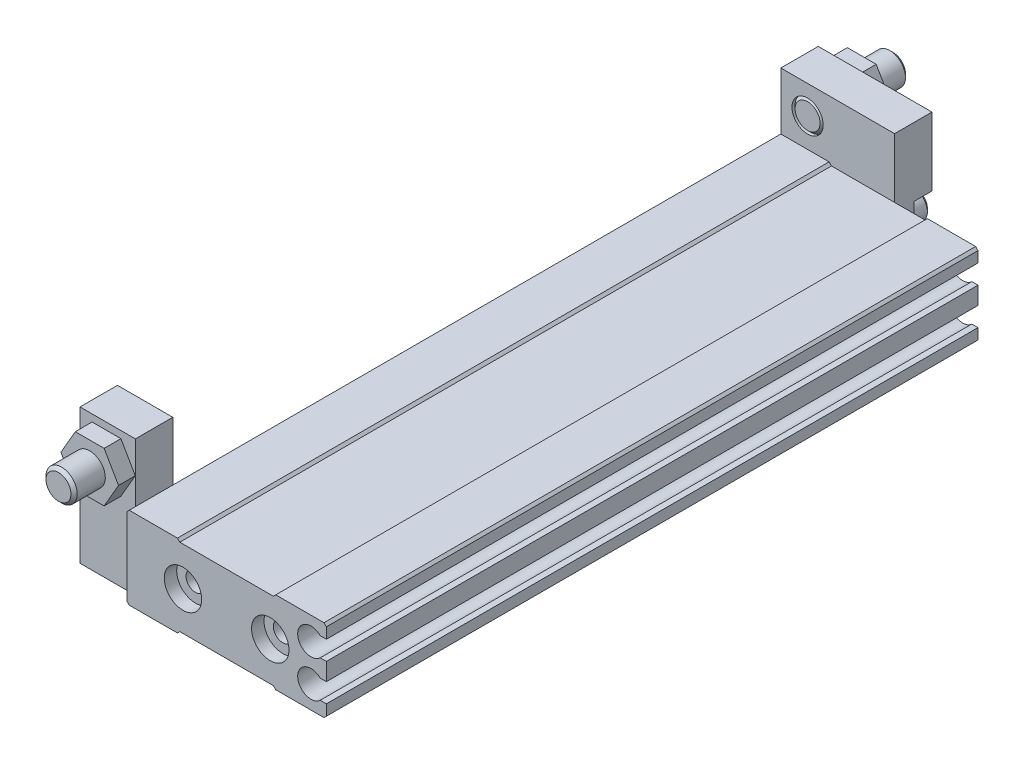
from build123d import *

# Parameters (mm, degrees)
BASE_EXTRUDE_START               = -104.5
BASE_EXTRUDE_DEPTH               = 104.5
SKETCH2_R                        = 3
CUT_EXTRUDE1_DEPTH               = 103.2
SKETCH4_R                        = 3
BOSS_EXTRUDE1_DEPTH              = 10
CUT_EXTRUDE3_REACH               = 105.95
SKETCH19_R                       = 1.5
F_4_40_TAPPED_HOLE2_D            = 2.2606
F_4_40_TAPPED_HOLE2_DEPTH        = 8.8646
F_4_40_TAPPED_HOLE2_CBORE_D      = 2.8448
F_4_40_TAPPED_HOLE2_CBORE_DEPTH  = 5.6896
F_4_40_TAPPED_HOLE2_TIP          = 0.679152758
F_3_48_TAPPED_HOLE1_D            = 2.0828
F_3_48_TAPPED_HOLE1_DEPTH        = 7.3025
F_3_48_TAPPED_HOLE1_CBORE_D      = 2.5146
F_3_48_TAPPED_HOLE1_CBORE_DEPTH  = 5.0292
F_3_48_TAPPED_HOLE1_TIP          = 0.625736249
HOLE1_D                          = 3.1877
HOLE1_DEPTH                      = 2.54
CUT_EXTRUDE4_DEPTH               = 2.5
F_10_32_TAPPED_HOLE1_D           = 4.0386
F_10_32_TAPPED_HOLE1_DEPTH       = 13.6144
F_10_32_TAPPED_HOLE1_CBORE_D     = 4.826
F_10_32_TAPPED_HOLE1_CBORE_DEPTH = 9.652
F_10_32_TAPPED_HOLE1_TIP         = 1.213317848
SKETCH30_W                       = 18.237
SKETCH30_H                       = 21.59
BOSS_EXTRUDE2_DEPTH              = 6
CUT_EXTRUDE9_DEPTH               = 2.87
BOSS_EXTRUDE3_DEPTH              = 2.6924
SKETCH35_R                       = 2.25
BOSS_EXTRUDE5_DEPTH              = 3
CHAMFER2_SIZE                    = 0.5
BOSS_EXTRUDE6_DEPTH              = 6
BOSS_EXTRUDE7_DEPTH              = 2.69
CUT_EXTRUDE7_REACH               = 120.219
SKETCH38_R                       = 2.5
CUT_EXTRUDE8_REACH               = 125.073
SKETCH46_R                       = 2.5
CHAMFER3_SIZE                    = 0.5


with BuildPart() as part:
    # Sketch1 → Base-Extrude (new body)
    with BuildSketch(Plane(origin=(0, 0, 57.15), x_dir=(-1, 0, 0), z_dir=(0, 0, 1)).offset(BASE_EXTRUDE_START)):
        with BuildLine():
            Line((15.619, 6.5913), (16, 6.2103))
            Line((16, 6.2103), (16, -6.2103))
            Line((16, -6.2103), (15.619, -6.5913))
            Line((15.619, -6.5913), (7.881, -6.5913))
            Line((7.881, -6.5913), (7.5, -6.2103))
            Line((7.5, -6.2103), (-7.5, -6.2103))
            Line((-7.5, -6.2103), (-7.881, -6.5913))
            Line((-7.881, -6.5913), (-15.619, -6.5913))
            Line((-15.619, -6.5913), (-16, -6.2103))
            Line((-16, -6.2103), (-16, -4.4831))
            Line((-16, -4.4831), (-15.013735828, -4.4831))
            ThreePointArc((-15.013735828, -4.4831), (-11.4, -2.9464), (-15.013735828, -1.4097))
            Line((-15.013735828, -1.4097), (-16, -1.4097))
            Line((-16, -1.4097), (-16, 1.4097))
            Line((-16, 1.4097), (-15.013735828, 1.4097))
            ThreePointArc((-15.013735828, 1.4097), (-11.4, 2.9464), (-15.013735828, 4.4831))
            Line((-15.013735828, 4.4831), (-16, 4.4831))
            Line((-16, 4.4831), (-16, 6.2103))
            Line((-16, 6.2103), (-15.619, 6.5913))
            Line((-15.619, 6.5913), (-7.881, 6.5913))
            Line((-7.881, 6.5913), (-7.5, 6.2103))
            Line((-7.5, 6.2103), (7.5, 6.2103))
            Line((7.5, 6.2103), (7.881, 6.5913))
            Line((7.881, 6.5913), (15.619, 6.5913))
        make_face()
    extrude(amount=BASE_EXTRUDE_DEPTH)

    # Sketch2 → Cut-Extrude1 (cut)
    with BuildSketch(Plane(origin=(0, 0, 57.15), x_dir=(-1, 0, 0), z_dir=(0, 0, -1))):
        with Locations(Location((-7, 0, 0), (0, 0, 180))):
            Circle(SKETCH2_R)
        with Locations(Location((7, 0, 0), (0, 0, 180))):
            Circle(SKETCH2_R)
    extrude(amount=CUT_EXTRUDE1_DEPTH, mode=Mode.SUBTRACT)

    # Sketch4 → Boss-Extrude1 (add)
    with BuildSketch(Plane.XY.offset(55.15)):
        with Locations((7, 0)):
            Circle(SKETCH4_R)
        with Locations((-7, 0)):
            Circle(SKETCH4_R)
    extrude(amount=-BOSS_EXTRUDE1_DEPTH)

    # Sketch19 → Cut-Extrude3 (cut, up to next)
    with BuildSketch(Plane.XY.offset(55.15), mode=Mode.PRIVATE) as cut_extrude3_sk1:
        with Locations((7, 0)):
            Circle(SKETCH19_R)
    cut_extrude3_tool1 = extrude(cut_extrude3_sk1.sketch, amount=-CUT_EXTRUDE3_REACH, mode=Mode.PRIVATE) & part.part
    # Sketch19 → Cut-Extrude3 (cut, up to next)
    with BuildSketch(Plane.XY.offset(55.15), mode=Mode.PRIVATE) as cut_extrude3_sk2:
        with Locations((-7, 0)):
            Circle(SKETCH19_R)
    cut_extrude3_tool2 = extrude(cut_extrude3_sk2.sketch, amount=-CUT_EXTRUDE3_REACH, mode=Mode.PRIVATE) & part.part
    add(cut_extrude3_tool1.solids().sort_by_distance((7, 0, 55.15))[0], mode=Mode.SUBTRACT)
    add(cut_extrude3_tool2.solids().sort_by_distance((-7, 0, 55.15))[0], mode=Mode.SUBTRACT)

    # #4-40 Tapped Hole2
    with Locations(Plane.XZ.offset(6.2103)):
        with Locations((0, 41.85), (0, 26.85)):
            CounterBoreHole(F_4_40_TAPPED_HOLE2_D / 2, F_4_40_TAPPED_HOLE2_CBORE_D / 2, F_4_40_TAPPED_HOLE2_CBORE_DEPTH, depth=F_4_40_TAPPED_HOLE2_DEPTH)
            with Locations((0, 0, -(F_4_40_TAPPED_HOLE2_DEPTH + F_4_40_TAPPED_HOLE2_TIP / 2))):  # 118° drill point
                Cone(0, F_4_40_TAPPED_HOLE2_D / 2, F_4_40_TAPPED_HOLE2_TIP, mode=Mode.SUBTRACT)

    # #3-48 Tapped Hole1
    with Locations(Plane(origin=(0, 0, -47.35), x_dir=(-1, 0, 0), z_dir=(0, 0, -1))):
        with Locations((13, -4.0913), (13, 3.9087), (0, -4.0913), (0, 1.9087)):
            CounterBoreHole(F_3_48_TAPPED_HOLE1_D / 2, F_3_48_TAPPED_HOLE1_CBORE_D / 2, F_3_48_TAPPED_HOLE1_CBORE_DEPTH, depth=F_3_48_TAPPED_HOLE1_DEPTH)
            with Locations((0, 0, -(F_3_48_TAPPED_HOLE1_DEPTH + F_3_48_TAPPED_HOLE1_TIP / 2))):  # 118° drill point
                Cone(0, F_3_48_TAPPED_HOLE1_D / 2, F_3_48_TAPPED_HOLE1_TIP, mode=Mode.SUBTRACT)

    # Hole1
    with Locations(Plane.XZ.offset(6.5913)):
        with Locations((-12, 44.15)):
            Hole(HOLE1_D / 2, depth=HOLE1_DEPTH)

    # Sketch27 → Cut-Extrude4 (cut)
    with BuildSketch(Plane.XZ.offset(6.5913)):
        with BuildLine():
            Line((-13.59385, 16.55615), (-13.59385, 15.74385))
            ThreePointArc((-13.59385, 15.74385), (-12, 14.15), (-10.40615, 15.74385))
            Line((-10.40615, 15.74385), (-10.40615, 16.55615))
            ThreePointArc((-10.40615, 16.55615), (-12, 18.15), (-13.59385, 16.55615))
        make_face()
    extrude(amount=-CUT_EXTRUDE4_DEPTH, mode=Mode.SUBTRACT)

    # #10-32 Tapped Hole1
    with Locations(Plane.ZY.offset(16)):
        with Locations((45.85, -0.0913), (-40.65, -0.0913)):
            CounterBoreHole(F_10_32_TAPPED_HOLE1_D / 2, F_10_32_TAPPED_HOLE1_CBORE_D / 2, F_10_32_TAPPED_HOLE1_CBORE_DEPTH, depth=F_10_32_TAPPED_HOLE1_DEPTH)
            with Locations((0, 0, -(F_10_32_TAPPED_HOLE1_DEPTH + F_10_32_TAPPED_HOLE1_TIP / 2))):  # 118° drill point
                Cone(0, F_10_32_TAPPED_HOLE1_D / 2, F_10_32_TAPPED_HOLE1_TIP, mode=Mode.SUBTRACT)

    # Sketch30 → Boss-Extrude2 (add)
    with BuildSketch(Plane(origin=(0, 0, -47.35), x_dir=(-1, 0, 0), z_dir=(0, 0, -1))):
        with Locations((6.5005, 4.9657)):
            Rectangle(SKETCH30_W, SKETCH30_H)
    extrude(amount=BOSS_EXTRUDE2_DEPTH)

    # Sketch48 → Cut-Extrude9 (cut)
    with BuildSketch(Plane(origin=(0, 0, -53.35), x_dir=(-1, 0, 0), z_dir=(0, 0, -1))):
        with BuildLine():
            Line((15.619, -5.8293), (15.619, 6.7947))
            Line((15.619, 6.7947), (12.999, 6.7947))
            ThreePointArc((12.999, 6.7947), (11.224161979, 6.059538021), (10.489, 4.2847))
            Line((10.489, 4.2847), (10.489, -5.8293))
            Line((10.489, -5.8293), (15.619, -5.8293))
        make_face()
        with BuildLine():
            Line((-2.618, -5.8293), (2.512, -5.8293))
            Line((2.512, -5.8293), (2.512, 2.2807))
            ThreePointArc((2.512, 2.2807), (1.776838021, 4.055538021), (0.002, 4.7907))
            Line((0.002, 4.7907), (-2.618, 4.7907))
            Line((-2.618, 4.7907), (-2.618, -5.8293))
        make_face()
    extrude(amount=-CUT_EXTRUDE9_DEPTH, mode=Mode.SUBTRACT)

    # Sketch31 → Boss-Extrude3 (add)
    with BuildSketch(Plane(origin=(0, 0, -53.35), x_dir=(-1, 0, 0), z_dir=(0, 0, -1))):
        Polygon((15.947802154, 11.2316), (13.638401077, 15.2316), (9.019598923, 15.2316), (6.710197846, 11.2316), (9.019598923, 7.2316), (13.638401077, 7.2316), align=None)
    extrude(amount=BOSS_EXTRUDE3_DEPTH)

    # Sketch35 → Boss-Extrude5 (add)
    with BuildSketch(Plane(origin=(0, 0, -50.48), x_dir=(-1, 0, 0), z_dir=(0, 0, -1))):
        with Locations(Location((13, 3.9087, 0), (0, 0, 180))):
            Circle(SKETCH35_R)
        with Locations(Location((0, 1.9087, 0), (0, 0, 180))):
            Circle(SKETCH35_R)
        with Locations(Location((0, -4.0913, 0), (0, 0, 230.573908164))):
            Circle(SKETCH35_R)
        with Locations(Location((13, -4.0913, 0), (0, 0, 230.573908164))):
            Circle(SKETCH35_R)
    extrude(amount=BOSS_EXTRUDE5_DEPTH)

    # Chamfer2
    chamfer2_edges = [part.edges().sort_by_distance(p)[0] for p in [
        (-15.25, 3.9087, -53.48),
        (-2.25, 1.9087, -53.48),
        (-1.428935268, -2.3533, -53.48),
        (-14.428935268, -2.3533, -53.48),
    ]]
    chamfer(chamfer2_edges, length=CHAMFER2_SIZE)

    # Sketch36 → Boss-Extrude6 (add)
    with BuildSketch(Plane.XY.offset(49.65)):
        Polygon((-16.127, 15.4987), (-16.127, 4.5913), (-16, 4.5913), (-16, -6.2213), (-25, -6.2213), (-25, 15.4987), align=None)
    extrude(amount=BOSS_EXTRUDE6_DEPTH)

    # Sketch37 → Boss-Extrude7 (add)
    with BuildSketch(Plane.XY.offset(55.65)):
        Polygon((-18.450598923, 14.3687), (-23.069401077, 14.3687), (-25.378802154, 10.3687), (-23.069401077, 6.3687), (-18.450598923, 6.3687), (-16.141197846, 10.3687), align=None)
    extrude(amount=BOSS_EXTRUDE7_DEPTH)

    # Sketch38 → Cut-Extrude7 (cut, up to next)
    with BuildSketch(Plane.XY.offset(58.34), mode=Mode.PRIVATE) as cut_extrude7_sk1:
        with Locations((-20.76, 10.3687)):
            Circle(SKETCH38_R)
    cut_extrude7_tool1 = extrude(cut_extrude7_sk1.sketch, amount=-CUT_EXTRUDE7_REACH, mode=Mode.PRIVATE) & part.part
    add(cut_extrude7_tool1.solids().sort_by_distance((-20.76, 10.3687, 58.34))[0], mode=Mode.SUBTRACT)

    # Sketch44 → Boss-Revolve1 (revolve)
    with BuildSketch(Plane(origin=(0, 10.3687, 0), x_dir=(-1, 0, 0), z_dir=(0, 1, 0)), mode=Mode.PRIVATE) as boss_revolve1_sk:
        Polygon((20.76, 63.35), (23.26, 63.35), (23.26, 50.15), (22.76, 49.65), (20.76, 49.65), align=None)
    revolve(boss_revolve1_sk.sketch.rotate(Axis((-20.76, 10.3687, 58.34), (0, 0, -1)), 180), axis=Axis((-20.76, 10.3687, 58.34), (0, 0, -1)))

    # Sketch46 → Cut-Extrude8 (cut, up to next)
    with BuildSketch(Plane(origin=(0, 0, -56.0424), x_dir=(-1, 0, 0), z_dir=(0, 0, -1)), mode=Mode.PRIVATE) as cut_extrude8_sk1:
        with Locations((11.329, 11.2316)):
            Circle(SKETCH46_R)
    cut_extrude8_tool1 = extrude(cut_extrude8_sk1.sketch, amount=-CUT_EXTRUDE8_REACH, mode=Mode.PRIVATE) & part.part
    add(cut_extrude8_tool1.solids().sort_by_distance((-11.329, 11.2316, -56.0424))[0], mode=Mode.SUBTRACT)

    # Sketch47 → Boss-Revolve2 (revolve)
    with BuildSketch(Plane(origin=(0, 11.2316, 0), x_dir=(-1, 0, 0), z_dir=(0, 1, 0))):
        Polygon((13.329, -47.35), (11.329, -47.35), (11.329, -61.05), (13.829, -61.05), (13.829, -47.85), align=None)
    revolve(axis=Axis((-11.329, 11.2316, -47.35), (0, 0, -1)))

    # Chamfer3
    chamfer3_edges = [part.edges().sort_by_distance(p)[0] for p in [
        (-23.26, 10.3687, 63.35),
        (-8.829, 11.2316, -61.05),
    ]]
    chamfer(chamfer3_edges, length=CHAMFER3_SIZE)


solid = part.part
